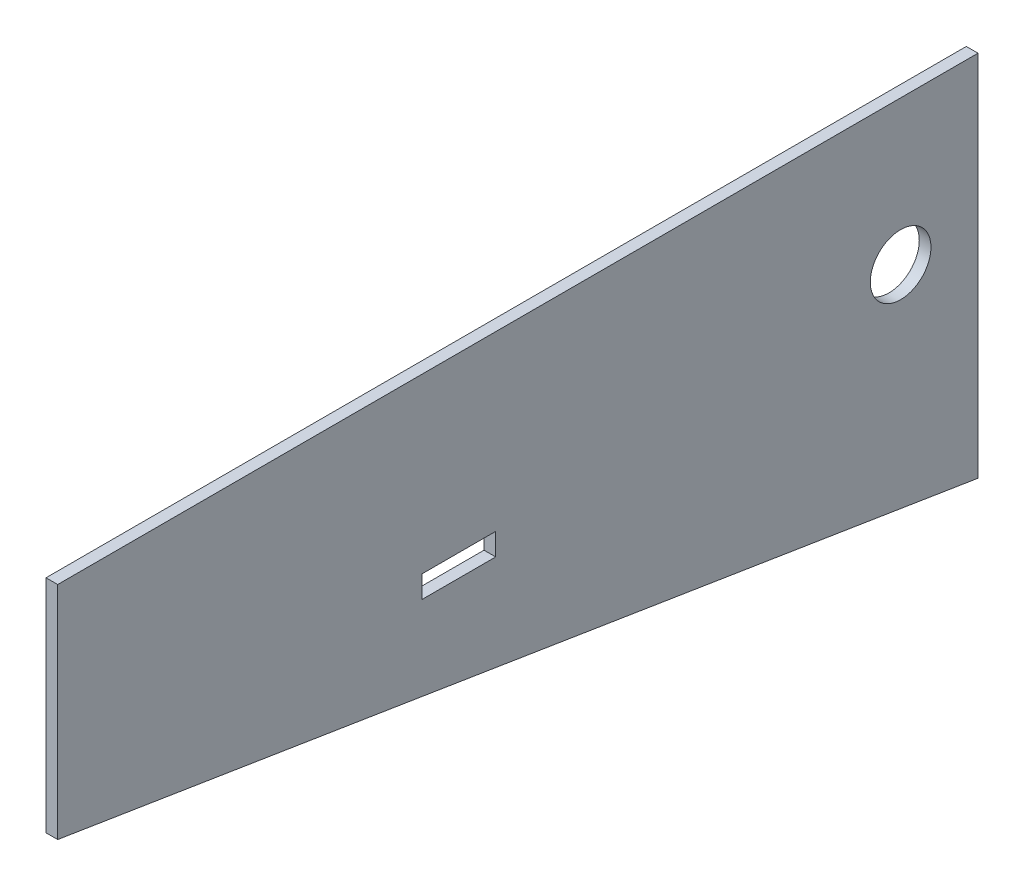
from build123d import *

# Parameters (mm, degrees)
BOSS_EXTRUDE1_DEPTH = 1.5875
SKETCH2_R           = 4.12
SKETCH2_W           = 10
SKETCH2_H           = 3.01
CUT_EXTRUDE1_DEPTH  = 1.5875


with BuildPart() as part:
    # Sketch1 → Boss-Extrude1 (new body)
    with BuildSketch(Plane(origin=(0, 0, 0), x_dir=(0, 0, -1), z_dir=(1, 0, 0))):
        Polygon((0, 17.849301165), (0, 30), (125, 30), (125, -20), (0, 0), (0, 4.461317534), (0, 9.461317534), align=None)
    extrude(amount=BOSS_EXTRUDE1_DEPTH)

    # Sketch2 → Cut-Extrude1 (cut)
    with BuildSketch(Plane(origin=(1.5875, 0, 0), x_dir=(0, 0, -1), z_dir=(1, 0, 0))):
        with Locations((114.49, 10.38)):
            Circle(SKETCH2_R)
        with Locations((54.49, 5.005)):
            Rectangle(SKETCH2_W, SKETCH2_H)
    extrude(amount=-CUT_EXTRUDE1_DEPTH, mode=Mode.SUBTRACT)


solid = part.part
